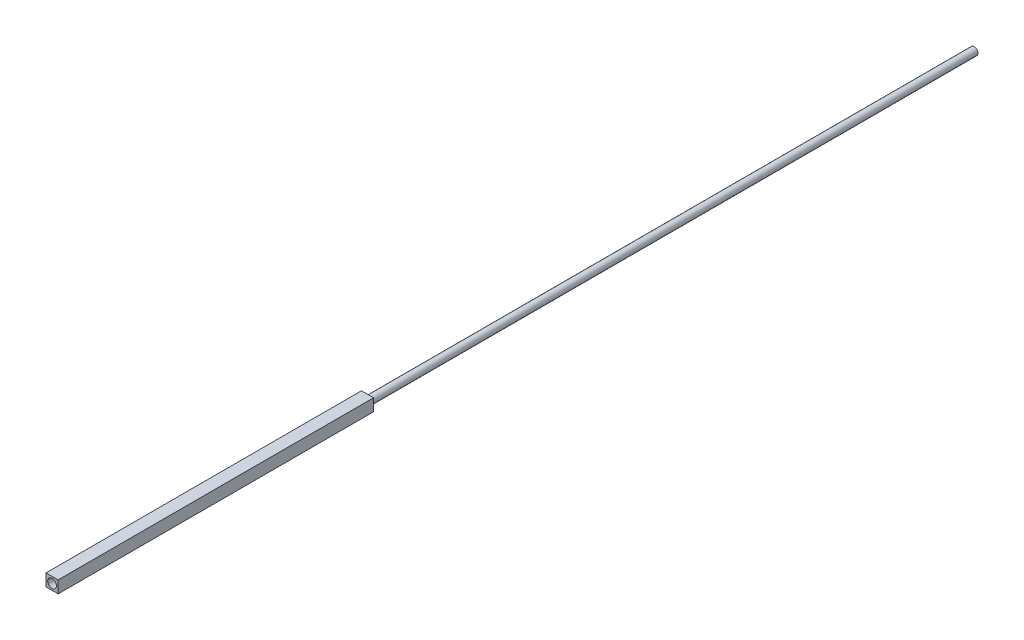
from build123d import *

# Parameters (mm, degrees)
SKETCH1_R                = 1.9939
SKETCH1_R_2              = 1.6939
BOSS_EXTRUDE1_DEPTH      = 330.2
CUT_EXTRUDE1_REACH       = 332.212
CUT_EXTRUDE1_END_RADIUS  = 1.9939
SKETCH2_W                = 2.54
SKETCH2_H                = 2.032
BOSS_EXTRUDE3_DEPTH      = 152.4
BOSS_EXTRUDE3_DEPTH_BACK = 12.7
SKETCH5_W                = 6.35
SKETCH5_H                = 6.35
SKETCH5_R                = 2.286


with BuildPart() as part:
    # Sketch1 → Boss-Extrude1 (new body)
    with BuildSketch(Plane.XY):
        Circle(SKETCH1_R)
        Circle(SKETCH1_R_2, mode=Mode.SUBTRACT)
    extrude(amount=BOSS_EXTRUDE1_DEPTH)

    # Cut-Extrude1: up to this cylinder (the profile starts inside it)
    cut_extrude1_end = Plane(origin=(0, 0, 1.27), z_dir=(0, 0, -1)) * Cylinder(CUT_EXTRUDE1_END_RADIUS, 669.4118, mode=Mode.PRIVATE)
    # Sketch2 → Cut-Extrude1 (cut, up to the surface)
    with BuildSketch(Plane(origin=(0, 0, 0), x_dir=(0, 0, -1), z_dir=(1, 0, 0)), mode=Mode.PRIVATE) as cut_extrude1_sk1:
        with Locations((-1.27, 0)):
            Rectangle(SKETCH2_W, SKETCH2_H)
    cut_extrude1_tool1 = extrude(cut_extrude1_sk1.sketch, amount=-CUT_EXTRUDE1_REACH, mode=Mode.PRIVATE) & cut_extrude1_end
    add(cut_extrude1_tool1.solids().sort_by_distance((0, 0, 1.27))[0], mode=Mode.SUBTRACT)


with BuildPart() as body_2:
    # Sketch5 → Boss-Extrude3 (new, two sides: drawn at the far end of the back side and taken through both)
    with BuildSketch(Plane.XY.offset(330.2).offset(-BOSS_EXTRUDE3_DEPTH_BACK)):
        Rectangle(SKETCH5_W, SKETCH5_H)
        Circle(SKETCH5_R, mode=Mode.SUBTRACT)
    extrude(amount=BOSS_EXTRUDE3_DEPTH + BOSS_EXTRUDE3_DEPTH_BACK)


solid = Compound([part.part, body_2.part])
